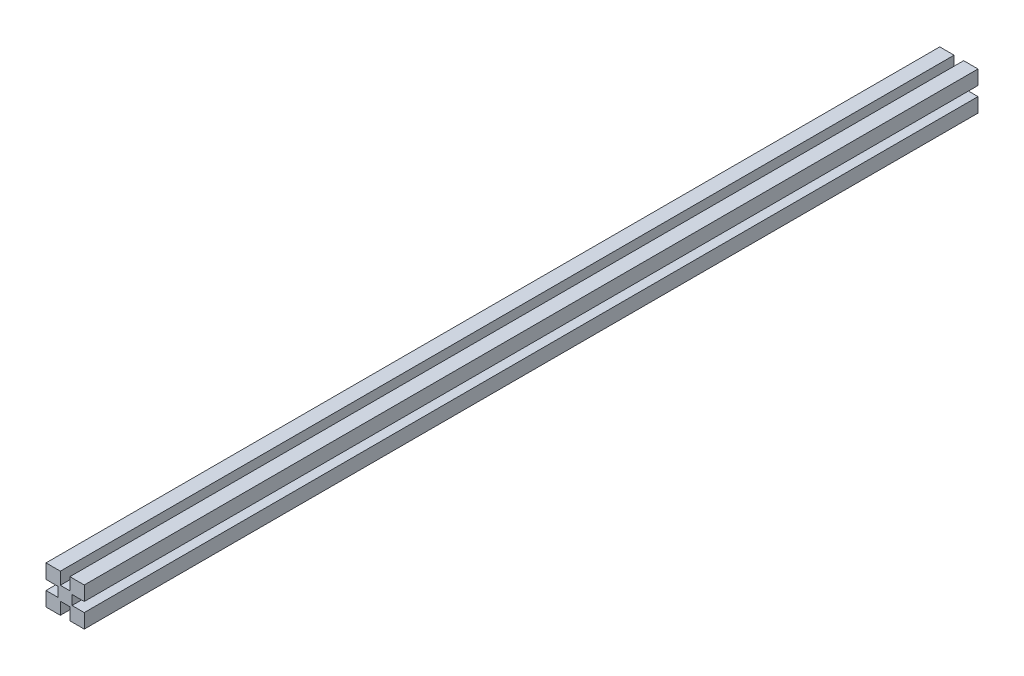
from build123d import *

# Parameters (mm, degrees)
BOSS_EXTRUDE1_DEPTH = 593.344


with BuildPart() as part:
    # Sketch1 → Boss-Extrude1 (new body)
    with BuildSketch(Plane.XY):
        Polygon((-12.7, 12.7), (-12.7, 3.175), (-4.572, 3.175), (-4.572, -3.175), (-12.7, -3.175), (-12.7, -12.7), (-3.175, -12.7), (-3.175, -4.572), (3.175, -4.572), (3.175, -12.7), (12.7, -12.7), (12.7, -3.175), (4.572, -3.175), (4.572, 3.175), (12.7, 3.175), (12.7, 12.7), (3.175, 12.7), (3.175, 4.572), (-3.175, 4.572), (-3.175, 12.7), align=None)
    extrude(amount=BOSS_EXTRUDE1_DEPTH)


solid = part.part
